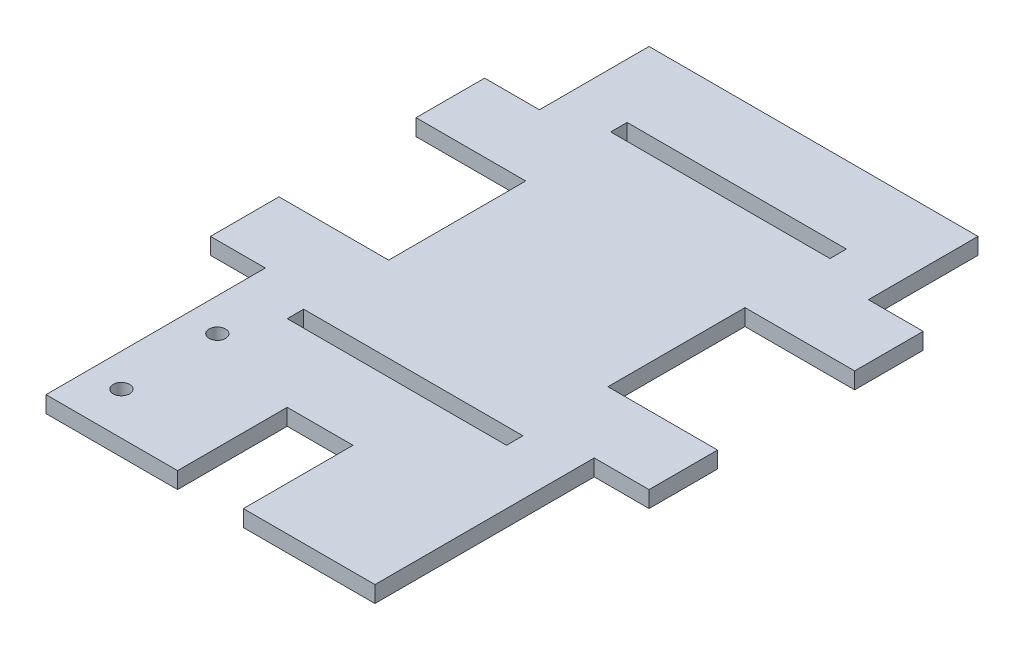
from build123d import *

# Parameters (mm, degrees)
SKETCH1_W           = 40
SKETCH1_H           = 3
BOSS_EXTRUDE1_DEPTH = 3
SKETCH3_R           = 1.5
SKETCH3_W           = 12
SKETCH3_H           = 20
SKETCH3_W_2         = 60
CUT_EXTRUDE2_DEPTH  = 10


with BuildPart() as part:
    # Sketch1 → Boss-Extrude1 (new body)
    with BuildSketch(Plane(origin=(0, 0, 0), x_dir=(1, 0, 0), z_dir=(0, 1, 0))):
        Polygon((20, 37.5), (20, 12.5), (0, 12.5), (0, 0), (10, 0), (10, -40), (70, -40), (70, 0), (80, 0), (80, 12.5), (60, 12.5), (60, 37.5), (80, 37.5), (80, 50), (70, 50), (70, 90), (10, 90), (10, 50), (0, 50), (0, 37.5), align=None)
        with Locations((40, -4.5)):
            Rectangle(SKETCH1_W, SKETCH1_H, mode=Mode.SUBTRACT)
        with Locations((40, 54.5)):
            Rectangle(SKETCH1_W, SKETCH1_H, mode=Mode.SUBTRACT)
    extrude(amount=BOSS_EXTRUDE1_DEPTH)

    # Sketch3 → Cut-Extrude2 (cut)
    with BuildSketch(Plane(origin=(0, 0, 0), x_dir=(1, 0, 0), z_dir=(0, 1, 0))):
        with Locations(Location((16, -32.25, 0), (0, 0, 270))):
            Circle(SKETCH3_R)
        with Locations(Location((16, -14.75, 0), (0, 0, 270))):
            Circle(SKETCH3_R)
        with Locations((40, -30)):
            Rectangle(SKETCH3_W, SKETCH3_H)
        with Locations((40, 80)):
            Rectangle(SKETCH3_W_2, SKETCH3_H)
    extrude(amount=CUT_EXTRUDE2_DEPTH, mode=Mode.SUBTRACT)


solid = part.part
